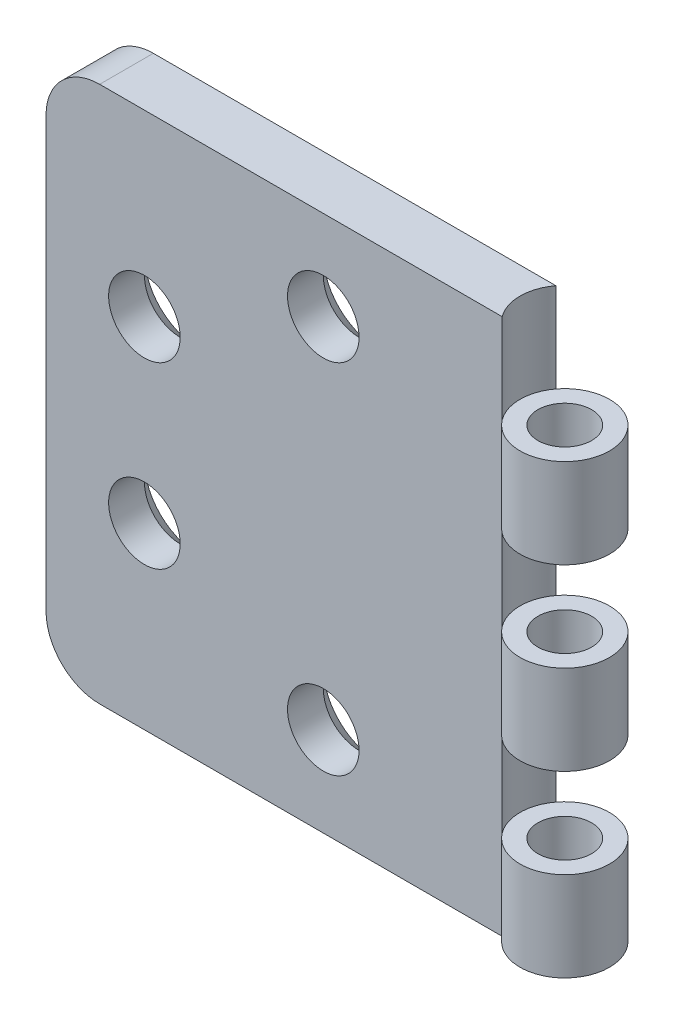
from build123d import *

# Parameters (mm, degrees)
SKETCH_1_W          = 30
SKETCH_1_H          = 30
EXTRUDE_1_DEPTH     = 3
CUT_EXTRUDE_1_DEPTH = 34.674916481
SKETCH_3_R          = 2.5
EXTRUDE_3_DEPTH     = 30
FILLET_1_R          = 3
CUT_EXTRUDE_2_DEPTH = 22.587033145
SKETCH_6_R          = 2.5
CUT_EXTRUDE_3_DEPTH = 5
SKETCH_7_R          = 2.5
CUT_EXTRUDE_4_DEPTH = 5
CUT_EXTRUDE_START   = -5
SKETCH_8_R          = 2.5
CUT_EXTRUDE_5_DEPTH = 5
SKETCH_9_R          = 1.5
CUT_EXTRUDE_6_DEPTH = 34.778691508
CHAMFER_1_SIZE      = 1


with BuildPart() as part:
    # Эскиз1 → Бобышка-Вытянуть1 (new body)
    with BuildSketch(Plane.XY):
        Rectangle(SKETCH_1_W, SKETCH_1_H)
    extrude(amount=EXTRUDE_1_DEPTH)

    # Эскиз2 → Вырез-Вытянуть1 (cut, through all)
    with BuildSketch(Plane.XZ.offset(15)):
        with BuildLine():
            Line((15, 0), (15, 1.5))
            ThreePointArc((15, 1.5), (14.871708245, 0.709430585), (14.5, 0))
            Line((14.5, 0), (15, 0))
        make_face()
        with BuildLine():
            ThreePointArc((14.5, 3), (14.871708245, 2.290569415), (15, 1.5))
            Line((15, 1.5), (15, 3))
            Line((15, 3), (14.5, 3))
        make_face()
    extrude(amount=-CUT_EXTRUDE_1_DEPTH, mode=Mode.SUBTRACT)

    # Эскиз3 → Бобышка-Вытянуть3 (add)
    with BuildSketch(Plane.XZ.offset(15)):
        with Locations((12.5, 1.5)):
            Circle(SKETCH_3_R)
    extrude(amount=-EXTRUDE_3_DEPTH)

    # Скругление1
    fillet_1_edges = [part.edges().sort_by_distance(p)[0] for p in [
        (-15, -15, 1.5),
        (-15, 15, 1.5),
    ]]
    fillet(fillet_1_edges, radius=FILLET_1_R)

    # Эскиз4 → Вырез-Вытянуть2 (cut, through all)
    with BuildSketch(Plane.XY.offset(3)):
        with BuildLine():
            ThreePointArc((-7.5, -5), (-8.085786438, -3.585786438), (-9.5, -3))
            Line((-9.5, -3), (-9.5, -7))
            ThreePointArc((-9.5, -7), (-8.085786438, -6.414213562), (-7.5, -5))
        make_face()
        with BuildLine():
            Line((-9.5, -7), (-9.5, -3))
            ThreePointArc((-9.5, -3), (-11.5, -5), (-9.5, -7))
        make_face()
        with BuildLine():
            ThreePointArc((0.5, -8), (-1.5, -10), (0.5, -12))
            Line((0.5, -12), (0.5, -8))
        make_face()
        with BuildLine():
            Line((0.5, -8), (0.5, -12))
            ThreePointArc((0.5, -12), (1.914213562, -11.414213562), (2.5, -10))
            ThreePointArc((2.5, -10), (1.914213562, -8.585786438), (0.5, -8))
        make_face()
        with BuildLine():
            ThreePointArc((-9.5, 7), (-11.5, 5), (-9.5, 3))
            Line((-9.5, 3), (-9.5, 5))
            Line((-9.5, 5), (-9.5, 7))
        make_face()
        with BuildLine():
            Line((-9.5, 5), (-9.5, 3))
            ThreePointArc((-9.5, 3), (-8.085786438, 3.585786438), (-7.5, 5))
            ThreePointArc((-7.5, 5), (-8.085786438, 6.414213562), (-9.5, 7))
            Line((-9.5, 7), (-9.5, 5))
        make_face()
        with BuildLine():
            ThreePointArc((0.5, 12), (-1.5, 10), (0.5, 8))
            Line((0.5, 8), (0.5, 10))
            Line((0.5, 10), (0.5, 12))
        make_face()
        with BuildLine():
            Line((0.5, 10), (0.5, 8))
            ThreePointArc((0.5, 8), (1.914213562, 8.585786438), (2.5, 10))
            ThreePointArc((2.5, 10), (1.914213562, 11.414213562), (0.5, 12))
            Line((0.5, 12), (0.5, 10))
        make_face()
    extrude(amount=-CUT_EXTRUDE_2_DEPTH, mode=Mode.SUBTRACT)

    # Эскиз6 → Вырез-Вытянуть3 (cut)
    with BuildSketch(Plane(origin=(0, -10, 0), x_dir=(-1, 0, 0), z_dir=(0, -1, 0))):
        with Locations((-12.5, -1.5)):
            Circle(SKETCH_6_R)
    extrude(amount=-CUT_EXTRUDE_3_DEPTH, mode=Mode.SUBTRACT)

    # Эскиз7 → Вырез-Вытянуть4 (cut)
    with BuildSketch(Plane(origin=(0, 0, 0), x_dir=(-1, 0, 0), z_dir=(0, -1, 0))):
        with Locations((-12.5, -1.5)):
            Circle(SKETCH_7_R)
    extrude(amount=-CUT_EXTRUDE_4_DEPTH, mode=Mode.SUBTRACT)

    # Эскиз8 → Вырез-Вытянуть5 (cut)
    with BuildSketch(Plane(origin=(0, 15, 0), x_dir=(1, 0, 0), z_dir=(0, 1, 0)).offset(CUT_EXTRUDE_START)):
        with Locations((12.5, -1.5)):
            Circle(SKETCH_8_R)
    extrude(amount=CUT_EXTRUDE_5_DEPTH, mode=Mode.SUBTRACT)

    # Эскиз9 → Вырез-Вытянуть6 (cut, through all)
    with BuildSketch(Plane.XZ.offset(15)):
        with Locations(Location((12.5, 1.5, 0), (0, 0, 270))):
            Circle(SKETCH_9_R)
    extrude(amount=-CUT_EXTRUDE_6_DEPTH, mode=Mode.SUBTRACT)

    # Фаска1
    chamfer_1_edges = [part.edges().sort_by_distance(p)[0] for p in [
        (-9.5, -3, 0),
        (0.5, -8, 0),
        (-9.5, 3, 0),
        (0.5, 8, 0),
    ]]
    chamfer(chamfer_1_edges, length=CHAMFER_1_SIZE)


solid = part.part
